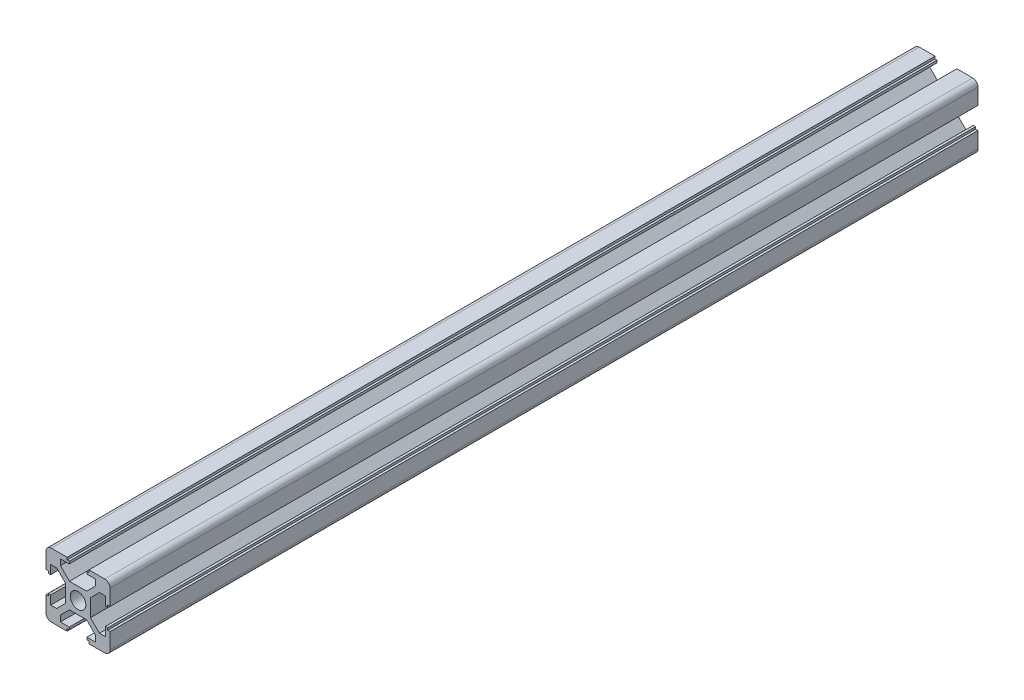
from build123d import *

# Parameters (mm, degrees)
SKETCH11_R                          = 3.65
BOSCHREXROTH_BOSCH_30X30_V2_1_DEPTH = 406.4


with BuildPart() as part:
    # Sketch11 → Boschrexroth BOSCH_30X30_V2(1) (new body)
    with BuildSketch(Plane.XY.offset(-203.2)):
        with BuildLine():
            Line((0, 5.8), (-4.03, 5.8))
            Line((-4.03, 5.8), (-8.25, 10.02))
            Line((-8.25, 10.02), (-8.25, 12.8))
            Line((-8.25, 12.8), (-4.1, 12.8))
            Line((-4.1, 12.8), (-4.1, 13.9))
            Line((-4.1, 13.9), (-5.1, 13.9))
            Line((-5.1, 13.9), (-5.1, 15))
            Line((-5.1, 15), (-12.5, 15))
            ThreePointArc((-12.5, 15), (-14.267766953, 14.267766953), (-15, 12.5))
            Line((-15, 12.5), (-15, 5.1))
            Line((-15, 5.1), (-13.9, 5.1))
            Line((-13.9, 5.1), (-13.9, 4.1))
            Line((-13.9, 4.1), (-12.8, 4.1))
            Line((-12.8, 4.1), (-12.8, 8.25))
            Line((-12.8, 8.25), (-10.02, 8.25))
            Line((-10.02, 8.25), (-5.8, 4.03))
            Line((-5.8, 4.03), (-5.8, 0))
            Line((-5.8, 0), (-5.8, -4.03))
            Line((-5.8, -4.03), (-10.02, -8.25))
            Line((-10.02, -8.25), (-12.8, -8.25))
            Line((-12.8, -8.25), (-12.8, -4.1))
            Line((-12.8, -4.1), (-13.9, -4.1))
            Line((-13.9, -4.1), (-13.9, -5.1))
            Line((-13.9, -5.1), (-15, -5.1))
            Line((-15, -5.1), (-15, -12.5))
            ThreePointArc((-15, -12.5), (-14.267766953, -14.267766953), (-12.5, -15))
            Line((-12.5, -15), (-5.1, -15))
            Line((-5.1, -15), (-5.1, -13.9))
            Line((-5.1, -13.9), (-4.1, -13.9))
            Line((-4.1, -13.9), (-4.1, -12.8))
            Line((-4.1, -12.8), (-8.25, -12.8))
            Line((-8.25, -12.8), (-8.25, -10.02))
            Line((-8.25, -10.02), (-4.03, -5.8))
            Line((-4.03, -5.8), (4.03, -5.8))
            Line((4.03, -5.8), (8.25, -10.02))
            Line((8.25, -10.02), (8.25, -12.8))
            Line((8.25, -12.8), (4.1, -12.8))
            Line((4.1, -12.8), (4.1, -13.9))
            Line((4.1, -13.9), (5.1, -13.9))
            Line((5.1, -13.9), (5.1, -15))
            Line((5.1, -15), (12.5, -15))
            ThreePointArc((12.5, -15), (14.267766953, -14.267766953), (15, -12.5))
            Line((15, -12.5), (15, -5.1))
            Line((15, -5.1), (13.9, -5.1))
            Line((13.9, -5.1), (13.9, -4.1))
            Line((13.9, -4.1), (12.8, -4.1))
            Line((12.8, -4.1), (12.8, -8.25))
            Line((12.8, -8.25), (10.02, -8.25))
            Line((10.02, -8.25), (5.8, -4.03))
            Line((5.8, -4.03), (5.8, 0))
            Line((5.8, 0), (5.8, 4.03))
            Line((5.8, 4.03), (10.02, 8.25))
            Line((10.02, 8.25), (12.8, 8.25))
            Line((12.8, 8.25), (12.8, 4.1))
            Line((12.8, 4.1), (13.9, 4.1))
            Line((13.9, 4.1), (13.9, 5.1))
            Line((13.9, 5.1), (15, 5.1))
            Line((15, 5.1), (15, 12.5))
            ThreePointArc((15, 12.5), (14.267766953, 14.267766953), (12.5, 15))
            Line((12.5, 15), (5.1, 15))
            Line((5.1, 15), (5.1, 13.9))
            Line((5.1, 13.9), (4.1, 13.9))
            Line((4.1, 13.9), (4.1, 12.8))
            Line((4.1, 12.8), (8.25, 12.8))
            Line((8.25, 12.8), (8.25, 10.02))
            Line((8.25, 10.02), (4.03, 5.8))
            Line((4.03, 5.8), (0, 5.8))
        make_face()
        Circle(SKETCH11_R, mode=Mode.SUBTRACT)
    extrude(amount=BOSCHREXROTH_BOSCH_30X30_V2_1_DEPTH)


solid = part.part
